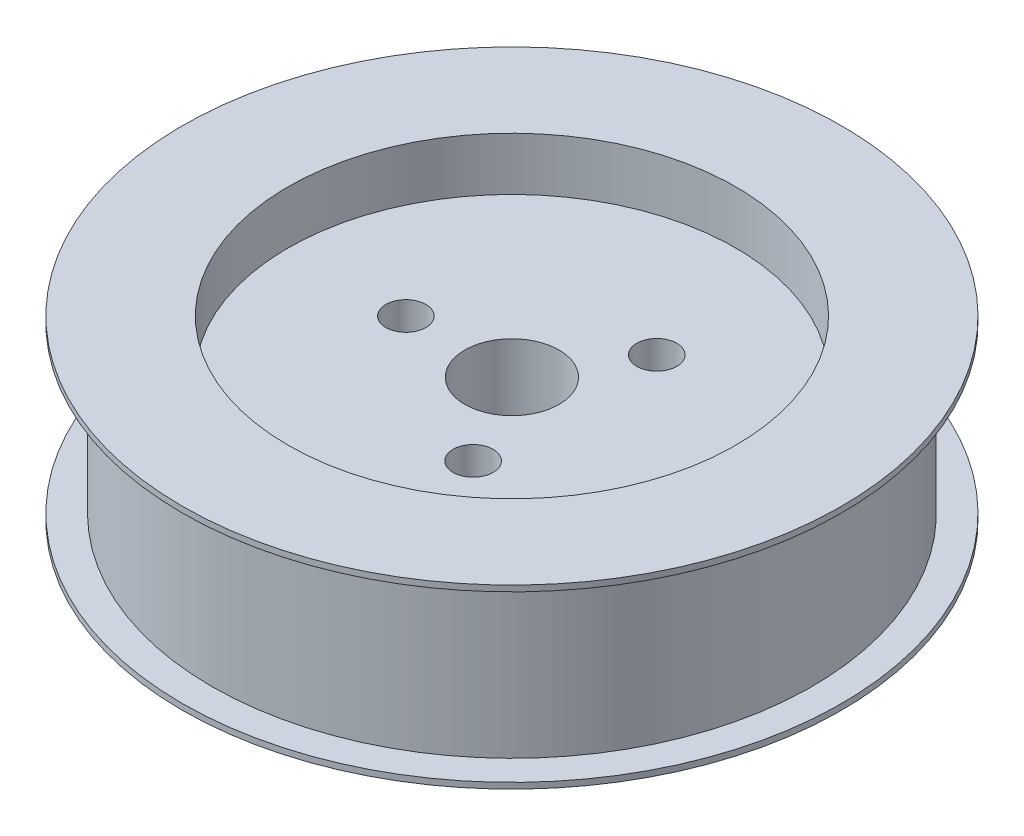
from build123d import *

# Parameters (mm, degrees)
CROQUIS1_R                   = 25.47
SALIENTE_EXTRUIR1_DEPTH      = 7.5
CROQUIS2_R                   = 27.97
SALIENTE_EXTRUIR2_DEPTH      = 0.5
SALIENTE_EXTRUIR3_START      = -14.5
CROQUIS2_2_R                 = 27.97
SALIENTE_EXTRUIR3_DEPTH      = 0.5
CROQUIS3_R                   = 19
SALIENTE_EXTRUIR4_DEPTH      = 21
CORTAR_EXTRUIR1_DEPTH        = 45.552124528
CORTAR_EXTRUIR1_DEPTH_BACK   = 45.552124528
CROQUIS4_R                   = 4
CORTAR_EXTRUIR2_START        = -10.5
CROQUIS5_R                   = 19
CORTAR_EXTRUIR2_DEPTH        = 10.5
TALADRO_DE_MARGEN_PARA_M31_D = 3.4


with BuildPart() as part:
    # Croquis1 → Saliente-Extruir1 (new, symmetric)
    with BuildSketch(Plane(origin=(0, 0, 0), x_dir=(-1, 0, 0), z_dir=(0, 1, 0))):
        with Locations(Location((0, 0, 0), (0, 0, 90))):
            Circle(CROQUIS1_R)
    extrude(amount=SALIENTE_EXTRUIR1_DEPTH, both=True)

    # Croquis2 → Saliente-Extruir2 (add)
    with BuildSketch(Plane(origin=(0, 7.5, 0), x_dir=(-1, 0, 0), z_dir=(0, 1, 0))):
        with Locations(Location((0, 0, 0), (0, 0, 90))):
            Circle(CROQUIS2_R)
    extrude(amount=-SALIENTE_EXTRUIR2_DEPTH)

    # Croquis2<2> → Saliente-Extruir3 (add)
    with BuildSketch(Plane(origin=(0, 7.5, 0), x_dir=(-1, 0, 0), z_dir=(0, 1, 0)).offset(SALIENTE_EXTRUIR3_START)):
        with Locations(Location((0, 0, 0), (0, 0, 90))):
            Circle(CROQUIS2_2_R)
    extrude(amount=-SALIENTE_EXTRUIR3_DEPTH)

    # Croquis3 → Saliente-Extruir4 (add)
    with BuildSketch(Plane(origin=(0, -7.5, 0), x_dir=(-1, 0, 0), z_dir=(0, 1, 0))):
        with Locations(Location((0, 0, 0), (0, 0, 270))):
            Circle(CROQUIS3_R)
    extrude(amount=SALIENTE_EXTRUIR4_DEPTH)

    # Croquis4 → Cortar-Extruir1 (cut, two sides: drawn at the far end of the back side and taken through both)
    with BuildSketch(Plane(origin=(0, -7, 0), x_dir=(-1, 0, 0), z_dir=(0, 1, 0)).offset(-CORTAR_EXTRUIR1_DEPTH_BACK)):
        with Locations(Location((0, 0, 0), (0, 0, 90))):
            Circle(CROQUIS4_R)
    extrude(amount=CORTAR_EXTRUIR1_DEPTH + CORTAR_EXTRUIR1_DEPTH_BACK, mode=Mode.SUBTRACT)

    # Croquis5 → Cortar-Extruir2 (cut)
    with BuildSketch(Plane(origin=(0, 13.5, 0), x_dir=(-1, 0, 0), z_dir=(0, 1, 0)).offset(CORTAR_EXTRUIR2_START)):
        with Locations(Location((0, 0, 0), (0, 0, 90))):
            Circle(CROQUIS5_R)
    cortar_extruir2 = extrude(amount=CORTAR_EXTRUIR2_DEPTH, mode=Mode.SUBTRACT)

    # Simetría1: Cortar-Extruir2 across plane
    add(cortar_extruir2.mirror(Plane.ZX), mode=Mode.SUBTRACT)

    # Taladro de margen para M31 (through all)
    with Locations(Plane(origin=(0, 7.5, 0), x_dir=(-1, 0, 0), z_dir=(0, 1, 0))):
        with Locations((0, 0), (9, 0), (-4.5, -7.794228634), (-4.5, 7.794228634)):
            Hole(TALADRO_DE_MARGEN_PARA_M31_D / 2)


solid = part.part
